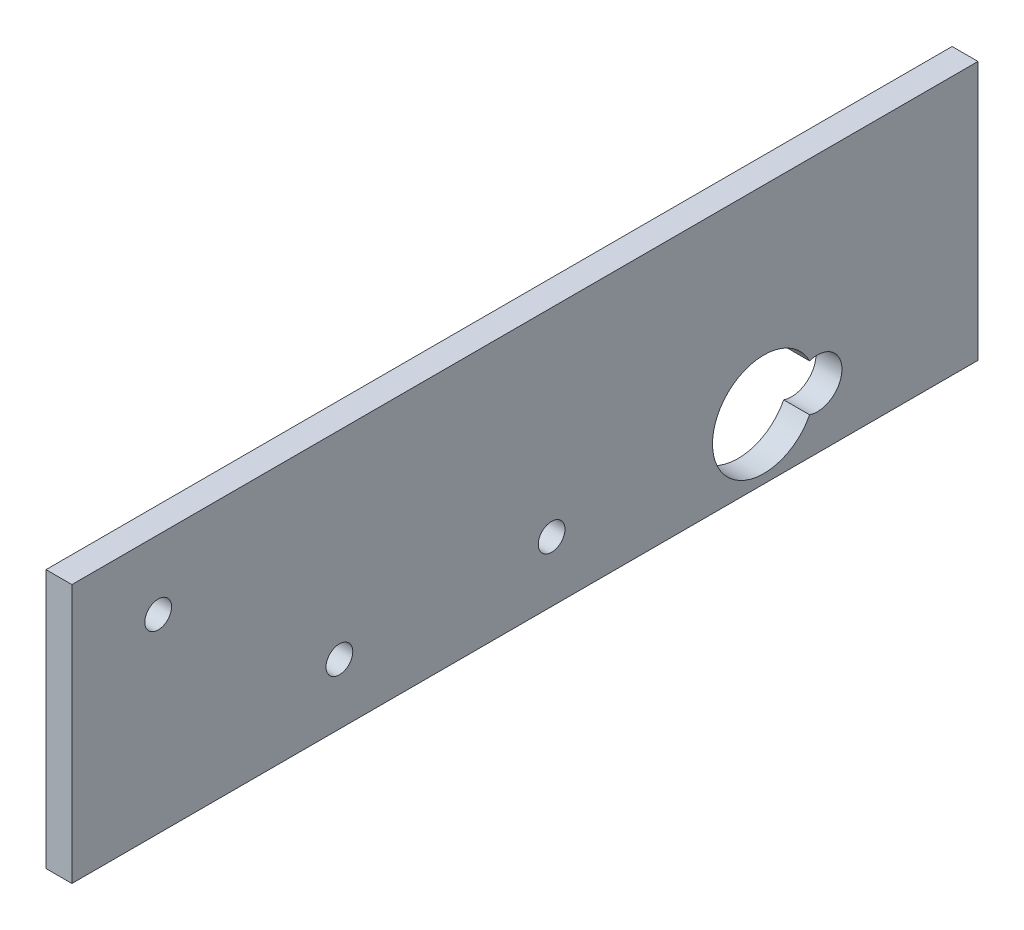
from build123d import *

# Parameters (mm, degrees)
SKIZZE1_W                       = 105
SKIZZE1_H                       = 30
AUFSATZ_LINEAR_AUSTRAGEN1_DEPTH = 3
SKIZZE2_R                       = 1.55
BOHRUNGEN_DEPTH                 = 110.242848736
SCHNITT_LINEAR_AUSTRAGEN4_DEPTH = 3


with BuildPart() as part:
    # Skizze1 → Aufsatz-Linear austragen1 (new body)
    with BuildSketch(Plane(origin=(0, 0, 0), x_dir=(0, 0, -1), z_dir=(1, 0, 0))):
        with Locations((52.5, 15)):
            Rectangle(SKIZZE1_W, SKIZZE1_H)
    extrude(amount=AUFSATZ_LINEAR_AUSTRAGEN1_DEPTH)

    # Skizze2 → Bohrungen (cut, through all)
    with BuildSketch(Plane(origin=(3, 0, 0), x_dir=(0, 0, -1), z_dir=(1, 0, 0))):
        with Locations((10, 22)):
            Circle(SKIZZE2_R)
        with Locations((31, 7)):
            Circle(SKIZZE2_R)
        with Locations((55.59187467, 7)):
            Circle(SKIZZE2_R)
        with Locations((80.183749339, 7)):
            Circle(SKIZZE2_R)
    extrude(amount=-BOHRUNGEN_DEPTH, mode=Mode.SUBTRACT)

    # Skizze7 → Schnitt-Linear austragen4 (cut)
    with BuildSketch(Plane(origin=(0, 0, 0), x_dir=(0, 0, -1), z_dir=(1, 0, 0))):
        with BuildLine():
            ThreePointArc((85.483749339, 9.704163457), (74.233749339, 7), (85.483749339, 4.295836543))
            ThreePointArc((85.483749339, 4.295836543), (89.233749339, 7), (85.483749339, 9.704163457))
        make_face()
    extrude(amount=SCHNITT_LINEAR_AUSTRAGEN4_DEPTH, mode=Mode.SUBTRACT)


solid = part.part
